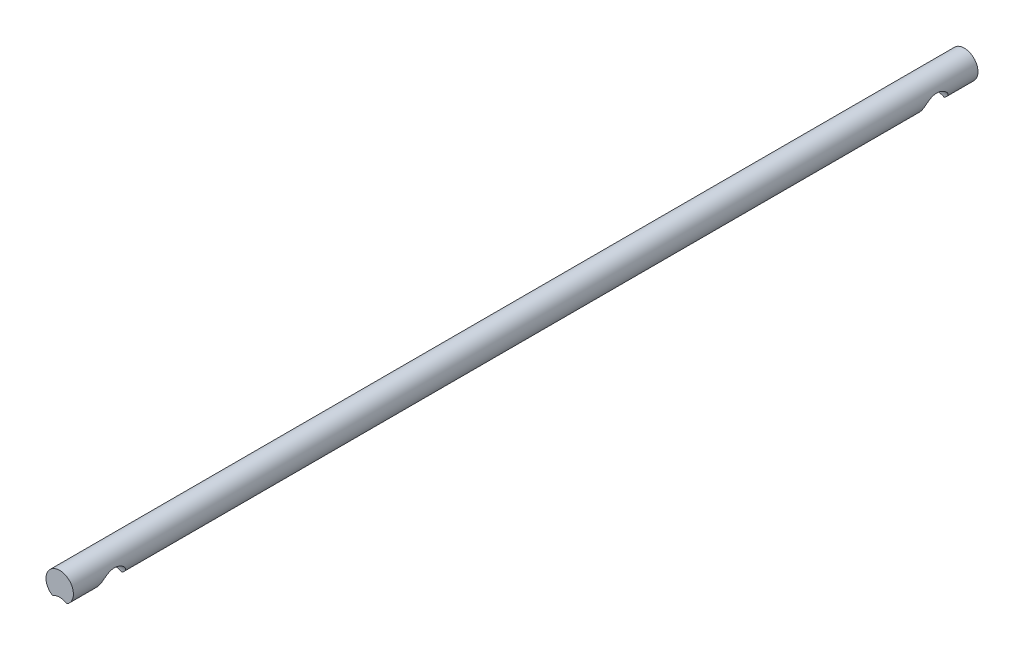
from build123d import *

# Parameters (mm, degrees)
EXTRUDE_1_DEPTH     = 3300
SKETCH_2_R          = 100
CUT_EXTRUDE_1_DEPTH = 3000


with BuildPart() as part:
    # Эскиз1 → Бобышка-Вытянуть1 (new, symmetric)
    with BuildSketch(Plane.XY):
        with BuildLine():
            ThreePointArc((100, 0), (70.710678119, 70.710678119), (0, 100))
            Line((0, 100), (0, -70))
            ThreePointArc((0, -70), (27.658633372, -73.708341903), (53.363596856, -84.571428571))
            ThreePointArc((53.363596856, -84.571428571), (87.568143995, -48.288923753), (100, 0))
        make_face()
        with BuildLine():
            Line((0, -70), (0, 100))
            ThreePointArc((0, 100), (-96.065453877, 27.774602993), (-53.363596856, -84.571428571))
            ThreePointArc((-53.363596856, -84.571428571), (-27.658633372, -73.708341903), (0, -70))
        make_face()
        with BuildLine():
            ThreePointArc((100, 0), (70.710678119, 70.710678119), (0, 100))
            Line((0, 100), (0, -70))
            ThreePointArc((0, -70), (27.658633372, -73.708341903), (53.363596856, -84.571428571))
            ThreePointArc((53.363596856, -84.571428571), (87.568143995, -48.288923753), (100, 0))
        make_face()
        with BuildLine():
            Line((0, -70), (0, 100))
            ThreePointArc((0, 100), (-96.065453877, 27.774602993), (-53.363596856, -84.571428571))
            ThreePointArc((-53.363596856, -84.571428571), (-27.658633372, -73.708341903), (0, -70))
        make_face()
    extrude(amount=EXTRUDE_1_DEPTH, both=True)

    # Эскиз2 → Вырез-Вытянуть1 (cut, symmetric)
    with BuildSketch(Plane(origin=(0, 0, 0), x_dir=(0, 0, -1), z_dir=(1, 0, 0))):
        with Locations((-3000, -84.571428571)):
            Circle(SKETCH_2_R)
        with Locations((3000, -84.571428571)):
            Circle(SKETCH_2_R)
    extrude(amount=CUT_EXTRUDE_1_DEPTH, both=True, mode=Mode.SUBTRACT)


solid = part.part
